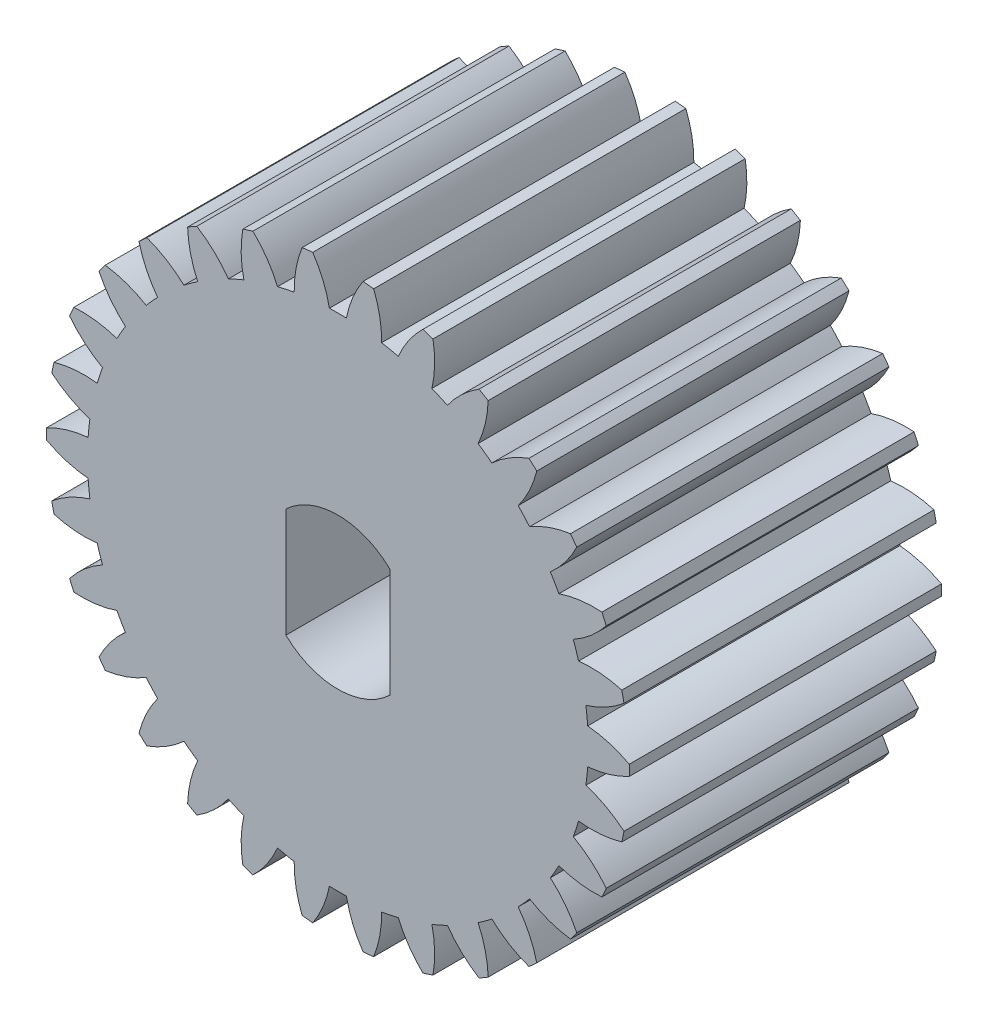
from build123d import *

# Parameters (mm, degrees)
SALIENTE_EXTRUIR1_DEPTH = 12


with BuildPart() as part:
    # Croquis1 → Saliente-Extruir1 (new body)
    with BuildSketch(Plane.XY):
        with BuildLine():
            ThreePointArc((-171.199709785, 34.79610564), (-170.424471106, 34.477979382), (-169.601507349, 34.320087074))
            ThreePointArc((-169.601507349, 34.320087074), (-169.572848525, 33.994233895), (-169.5331324, 33.669542885))
            ThreePointArc((-169.5331324, 33.669542885), (-170.305284767, 33.343997116), (-170.997440452, 32.871641496))
            ThreePointArc((-170.997440452, 32.871641496), (-170.956822932, 32.671604888), (-170.912566665, 32.47234172))
            ThreePointArc((-170.912566665, 32.47234172), (-170.088126643, 32.322348469), (-169.250318963, 32.339010272))
            ThreePointArc((-169.250318963, 32.339010272), (-169.154537717, 32.026236271), (-169.048182427, 31.716897986))
            ThreePointArc((-169.048182427, 31.716897986), (-169.735776641, 31.237926669), (-170.314598809, 30.631985893))
            ThreePointArc((-170.314598809, 30.631985893), (-170.233278929, 30.444765423), (-170.148560626, 30.259058028))
            ThreePointArc((-170.148560626, 30.259058028), (-169.310951246, 30.283753208), (-168.494915857, 30.474240923))
            ThreePointArc((-168.494915857, 30.474240923), (-168.33619829, 30.188215825), (-168.167852073, 29.907749831))
            ThreePointArc((-168.167852073, 29.907749831), (-168.740836967, 29.296286311), (-169.18102831, 28.5832429))
            ThreePointArc((-169.18102831, 28.5832429), (-169.062560141, 28.417021), (-168.941082397, 28.252985683))
            ThreePointArc((-168.941082397, 28.252985683), (-168.126911208, 28.451289996), (-167.368312773, 28.807278395))
            ThreePointArc((-167.368312773, 28.807278395), (-167.153595604, 28.56050287), (-166.930615997, 28.321166877))
            ThreePointArc((-166.930615997, 28.321166877), (-167.363949382, 27.603935044), (-167.646271427, 26.814952415))
            ThreePointArc((-167.646271427, 26.814952415), (-167.495832595, 26.67699378), (-167.342904571, 26.541799672))
            ThreePointArc((-167.342904571, 26.541799672), (-166.587754762, 26.905046268), (-165.919747673, 27.410976949))
            ThreePointArc((-165.919747673, 27.410976949), (-165.658415072, 27.214236271), (-165.390547353, 27.026490412))
            ThreePointArc((-165.390547353, 27.026490412), (-165.665290481, 26.234836738), (-165.7774044, 25.404397219))
            ThreePointArc((-165.7774044, 25.404397219), (-165.601569804, 25.300731303), (-165.423875189, 25.200287034))
            ThreePointArc((-165.423875189, 25.200287034), (-164.760750428, 25.712600295), (-164.2125298, 26.34636166))
            ThreePointArc((-164.2125298, 26.34636166), (-163.916003257, 26.208254341), (-163.614954531, 26.080304009))
            ThreePointArc((-163.614954531, 26.080304009), (-163.719099809, 25.248827559), (-163.656105685, 24.413225342))
            ThreePointArc((-163.656105685, 24.413225342), (-163.462560141, 24.348382843), (-163.267865042, 24.28707831))
            ThreePointArc((-163.267865042, 24.28707831), (-162.725747065, 24.926067687), (-162.321272769, 25.659961324))
            ThreePointArc((-162.321272769, 25.659961324), (-162.002511916, 25.586523316), (-161.681439458, 25.523960555))
            ThreePointArc((-161.681439458, 25.523960555), (-161.610435237, 24.68900084), (-161.375086216, 23.884755751))
            ThreePointArc((-161.375086216, 23.884755751), (-161.172288592, 23.861570597), (-160.969102119, 23.842085103))
            ThreePointArc((-160.969102119, 23.842085103), (-160.571684083, 24.579823694), (-160.328633588, 25.381774929))
            ThreePointArc((-160.328633588, 25.381774929), (-160.001569804, 25.376215825), (-159.674506019, 25.381774929))
            ThreePointArc((-159.674506019, 25.381774929), (-159.431455525, 24.579823694), (-159.034037488, 23.842085103))
            ThreePointArc((-159.034037488, 23.842085103), (-158.830851015, 23.861570597), (-158.628053392, 23.884755751))
            ThreePointArc((-158.628053392, 23.884755751), (-158.392704371, 24.68900084), (-158.32170015, 25.523960555))
            ThreePointArc((-158.32170015, 25.523960555), (-158.000627691, 25.586523316), (-157.681866838, 25.659961324))
            ThreePointArc((-157.681866838, 25.659961324), (-157.277392543, 24.926067687), (-156.735274566, 24.28707831))
            ThreePointArc((-156.735274566, 24.28707831), (-156.540579467, 24.348382843), (-156.347033923, 24.413225342))
            ThreePointArc((-156.347033923, 24.413225342), (-156.284039799, 25.248827559), (-156.388185076, 26.080304009))
            ThreePointArc((-156.388185076, 26.080304009), (-156.087136351, 26.208254341), (-155.790609807, 26.34636166))
            ThreePointArc((-155.790609807, 26.34636166), (-155.242389179, 25.712600295), (-154.579264419, 25.200287034))
            ThreePointArc((-154.579264419, 25.200287034), (-154.401569804, 25.300731303), (-154.225735208, 25.404397219))
            ThreePointArc((-154.225735208, 25.404397219), (-154.337849126, 26.234836738), (-154.612592254, 27.026490412))
            ThreePointArc((-154.612592254, 27.026490412), (-154.344724536, 27.214236271), (-154.083391935, 27.410976949))
            ThreePointArc((-154.083391935, 27.410976949), (-153.415384846, 26.905046268), (-152.660235036, 26.541799672))
            ThreePointArc((-152.660235036, 26.541799672), (-152.507307013, 26.67699378), (-152.35686818, 26.814952415))
            ThreePointArc((-152.35686818, 26.814952415), (-152.639190225, 27.603935044), (-153.072523611, 28.321166877))
            ThreePointArc((-153.072523611, 28.321166877), (-152.849544003, 28.56050287), (-152.634826834, 28.807278395))
            ThreePointArc((-152.634826834, 28.807278395), (-151.876228399, 28.451289996), (-151.06205721, 28.252985683))
            ThreePointArc((-151.06205721, 28.252985683), (-150.940579467, 28.417021), (-150.822111297, 28.5832429))
            ThreePointArc((-150.822111297, 28.5832429), (-151.26230264, 29.296286311), (-151.835287535, 29.907749831))
            ThreePointArc((-151.835287535, 29.907749831), (-151.666941318, 30.188215825), (-151.50822375, 30.474240923))
            ThreePointArc((-151.50822375, 30.474240923), (-150.692188362, 30.283753208), (-149.854578982, 30.259058028))
            ThreePointArc((-149.854578982, 30.259058028), (-149.769860678, 30.444765423), (-149.688540799, 30.631985893))
            ThreePointArc((-149.688540799, 30.631985893), (-150.267362966, 31.237926669), (-150.95495718, 31.716897986))
            ThreePointArc((-150.95495718, 31.716897986), (-150.848601891, 32.026236271), (-150.752820645, 32.339010272))
            ThreePointArc((-150.752820645, 32.339010272), (-149.915012964, 32.322348469), (-149.090572942, 32.47234172))
            ThreePointArc((-149.090572942, 32.47234172), (-149.046316676, 32.671604888), (-149.005699155, 32.871641496))
            ThreePointArc((-149.005699155, 32.871641496), (-149.697854841, 33.343997116), (-150.470007208, 33.669542885))
            ThreePointArc((-150.470007208, 33.669542885), (-150.430291083, 33.994233895), (-150.401632258, 34.320087074))
            ThreePointArc((-150.401632258, 34.320087074), (-149.578668502, 34.477979382), (-148.803429823, 34.79610564))
            ThreePointArc((-148.803429823, 34.79610564), (-148.801569804, 35.000215825), (-148.803429823, 35.20432601))
            ThreePointArc((-148.803429823, 35.20432601), (-149.578668502, 35.522452268), (-150.401632258, 35.680344577))
            ThreePointArc((-150.401632258, 35.680344577), (-150.430291083, 36.006197756), (-150.470007208, 36.330888766))
            ThreePointArc((-150.470007208, 36.330888766), (-149.697854841, 36.656434534), (-149.005699155, 37.128790155))
            ThreePointArc((-149.005699155, 37.128790155), (-149.046316676, 37.328826762), (-149.090572942, 37.528089931))
            ThreePointArc((-149.090572942, 37.528089931), (-149.915012964, 37.678083182), (-150.752820645, 37.661421378))
            ThreePointArc((-150.752820645, 37.661421378), (-150.848601891, 37.974195379), (-150.95495718, 38.283533665))
            ThreePointArc((-150.95495718, 38.283533665), (-150.267362966, 38.762504982), (-149.688540799, 39.368445757))
            ThreePointArc((-149.688540799, 39.368445757), (-149.769860678, 39.555666228), (-149.854578982, 39.741373622))
            ThreePointArc((-149.854578982, 39.741373622), (-150.692188362, 39.716678442), (-151.50822375, 39.526190728))
            ThreePointArc((-151.50822375, 39.526190728), (-151.666941318, 39.812215825), (-151.835287535, 40.092681819))
            ThreePointArc((-151.835287535, 40.092681819), (-151.26230264, 40.704145339), (-150.822111297, 41.417188751))
            ThreePointArc((-150.822111297, 41.417188751), (-150.940579467, 41.583410651), (-151.06205721, 41.747445968))
            ThreePointArc((-151.06205721, 41.747445968), (-151.876228399, 41.549141654), (-152.634826834, 41.193153256))
            ThreePointArc((-152.634826834, 41.193153256), (-152.849544003, 41.439928781), (-153.072523611, 41.679264774))
            ThreePointArc((-153.072523611, 41.679264774), (-152.639190225, 42.396496607), (-152.35686818, 43.185479235))
            ThreePointArc((-152.35686818, 43.185479235), (-152.507307013, 43.323437871), (-152.660235036, 43.458631979))
            ThreePointArc((-152.660235036, 43.458631979), (-153.415384846, 43.095385382), (-154.083391935, 42.589454701))
            ThreePointArc((-154.083391935, 42.589454701), (-154.344724536, 42.786195379), (-154.612592254, 42.973941239))
            ThreePointArc((-154.612592254, 42.973941239), (-154.337849126, 43.765594912), (-154.225735208, 44.596034431))
            ThreePointArc((-154.225735208, 44.596034431), (-154.401569804, 44.699700348), (-154.579264419, 44.800144616))
            ThreePointArc((-154.579264419, 44.800144616), (-155.242389179, 44.287831355), (-155.790609807, 43.65406999))
            ThreePointArc((-155.790609807, 43.65406999), (-156.087136351, 43.79217731), (-156.388185076, 43.920127642))
            ThreePointArc((-156.388185076, 43.920127642), (-156.284039799, 44.751604091), (-156.347033923, 45.587206309))
            ThreePointArc((-156.347033923, 45.587206309), (-156.540579467, 45.652048808), (-156.735274566, 45.71335334))
            ThreePointArc((-156.735274566, 45.71335334), (-157.277392543, 45.074363963), (-157.681866838, 44.340470327))
            ThreePointArc((-157.681866838, 44.340470327), (-158.000627691, 44.413908335), (-158.32170015, 44.476471095))
            ThreePointArc((-158.32170015, 44.476471095), (-158.392704371, 45.311430811), (-158.628053392, 46.1156759))
            ThreePointArc((-158.628053392, 46.1156759), (-158.830851015, 46.138861053), (-159.034037488, 46.158346548))
            ThreePointArc((-159.034037488, 46.158346548), (-159.431455525, 45.420607956), (-159.674506019, 44.618656722))
            ThreePointArc((-159.674506019, 44.618656722), (-160.001569804, 44.624215825), (-160.328633588, 44.618656722))
            ThreePointArc((-160.328633588, 44.618656722), (-160.571684083, 45.420607956), (-160.969102119, 46.158346548))
            ThreePointArc((-160.969102119, 46.158346548), (-161.172288592, 46.138861053), (-161.375086216, 46.1156759))
            ThreePointArc((-161.375086216, 46.1156759), (-161.610435237, 45.311430811), (-161.681439458, 44.476471095))
            ThreePointArc((-161.681439458, 44.476471095), (-162.002511916, 44.413908335), (-162.321272769, 44.340470327))
            ThreePointArc((-162.321272769, 44.340470327), (-162.725747065, 45.074363963), (-163.267865042, 45.71335334))
            ThreePointArc((-163.267865042, 45.71335334), (-163.462560141, 45.652048808), (-163.656105685, 45.587206309))
            ThreePointArc((-163.656105685, 45.587206309), (-163.719099809, 44.751604091), (-163.614954531, 43.920127642))
            ThreePointArc((-163.614954531, 43.920127642), (-163.916003257, 43.79217731), (-164.2125298, 43.65406999))
            ThreePointArc((-164.2125298, 43.65406999), (-164.760750428, 44.287831355), (-165.423875189, 44.800144616))
            ThreePointArc((-165.423875189, 44.800144616), (-165.601569804, 44.699700348), (-165.7774044, 44.596034431))
            ThreePointArc((-165.7774044, 44.596034431), (-165.665290481, 43.765594912), (-165.390547353, 42.973941239))
            ThreePointArc((-165.390547353, 42.973941239), (-165.658415072, 42.786195379), (-165.919747673, 42.589454701))
            ThreePointArc((-165.919747673, 42.589454701), (-166.587754762, 43.095385382), (-167.342904571, 43.458631979))
            ThreePointArc((-167.342904571, 43.458631979), (-167.495832595, 43.323437871), (-167.646271427, 43.185479235))
            ThreePointArc((-167.646271427, 43.185479235), (-167.363949382, 42.396496607), (-166.930615997, 41.679264774))
            ThreePointArc((-166.930615997, 41.679264774), (-167.153595604, 41.439928781), (-167.368312773, 41.193153256))
            ThreePointArc((-167.368312773, 41.193153256), (-168.126911208, 41.549141654), (-168.941082397, 41.747445968))
            ThreePointArc((-168.941082397, 41.747445968), (-169.062560141, 41.583410651), (-169.18102831, 41.417188751))
            ThreePointArc((-169.18102831, 41.417188751), (-168.740836967, 40.704145339), (-168.167852073, 40.092681819))
            ThreePointArc((-168.167852073, 40.092681819), (-168.33619829, 39.812215825), (-168.494915857, 39.526190728))
            ThreePointArc((-168.494915857, 39.526190728), (-169.310951246, 39.716678442), (-170.148560626, 39.741373622))
            ThreePointArc((-170.148560626, 39.741373622), (-170.233278929, 39.555666228), (-170.314598809, 39.368445757))
            ThreePointArc((-170.314598809, 39.368445757), (-169.735776641, 38.762504982), (-169.048182427, 38.283533665))
            ThreePointArc((-169.048182427, 38.283533665), (-169.154537717, 37.974195379), (-169.250318963, 37.661421378))
            ThreePointArc((-169.250318963, 37.661421378), (-170.088126643, 37.678083182), (-170.912566665, 37.528089931))
            ThreePointArc((-170.912566665, 37.528089931), (-170.956822932, 37.328826762), (-170.997440452, 37.128790155))
            ThreePointArc((-170.997440452, 37.128790155), (-170.305284767, 36.656434534), (-169.5331324, 36.330888766))
            ThreePointArc((-169.5331324, 36.330888766), (-169.572848525, 36.006197756), (-169.601507349, 35.680344577))
            ThreePointArc((-169.601507349, 35.680344577), (-170.424471106, 35.522452268), (-171.199709785, 35.20432601))
            ThreePointArc((-171.199709785, 35.20432601), (-171.201569804, 35.000215825), (-171.199709785, 34.79610564))
        make_face()
        with BuildLine():
            Line((-162.001569804, 37.100215825), (-162.001569804, 32.900215825))
            ThreePointArc((-162.001569804, 32.900215825), (-160.001569804, 32.100215825), (-158.001569804, 32.900215825))
            Line((-158.001569804, 32.900215825), (-158.001569804, 37.100215825))
            ThreePointArc((-158.001569804, 37.100215825), (-160.001569804, 37.900215825), (-162.001569804, 37.100215825))
        make_face(mode=Mode.SUBTRACT)
    extrude(amount=SALIENTE_EXTRUIR1_DEPTH)


solid = part.part
